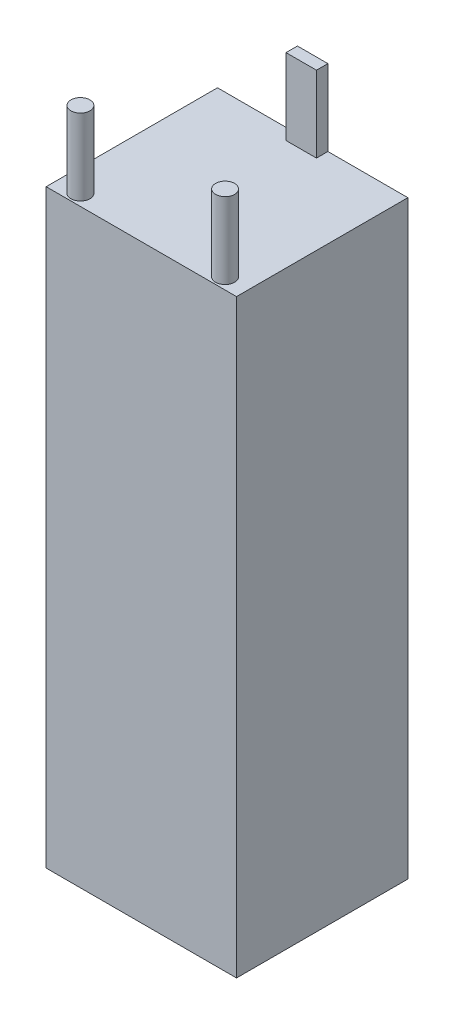
from build123d import *

# Parameters (mm, degrees)
SKETCH_1_W      = 50
SKETCH_1_H      = 45
EXTRUDE_1_DEPTH = 155
SKETCH_2_R      = 2.5
SKETCH_2_W      = 8
SKETCH_2_H      = 3
EXTRUDE_2_DEPTH = 20


with BuildPart() as part:
    # 草图1 → 凸台-拉伸1 (new body)
    with BuildSketch(Plane(origin=(0, 0, 0), x_dir=(1, 0, 0), z_dir=(0, 1, 0))):
        Rectangle(SKETCH_1_W, SKETCH_1_H)
    extrude(amount=EXTRUDE_1_DEPTH)

    # 草图2 → 凸台-拉伸2 (add)
    with BuildSketch(Plane(origin=(0, 155, 0), x_dir=(1, 0, 0), z_dir=(0, 1, 0))):
        with Locations(Location((-19, -19.5, 0), (0, 0, 90))):
            Circle(SKETCH_2_R)
        with Locations(Location((19, -19.5, 0), (0, 0, 90))):
            Circle(SKETCH_2_R)
        with Locations((0, 21)):
            Rectangle(SKETCH_2_W, SKETCH_2_H)
    extrude(amount=EXTRUDE_2_DEPTH)


solid = part.part
